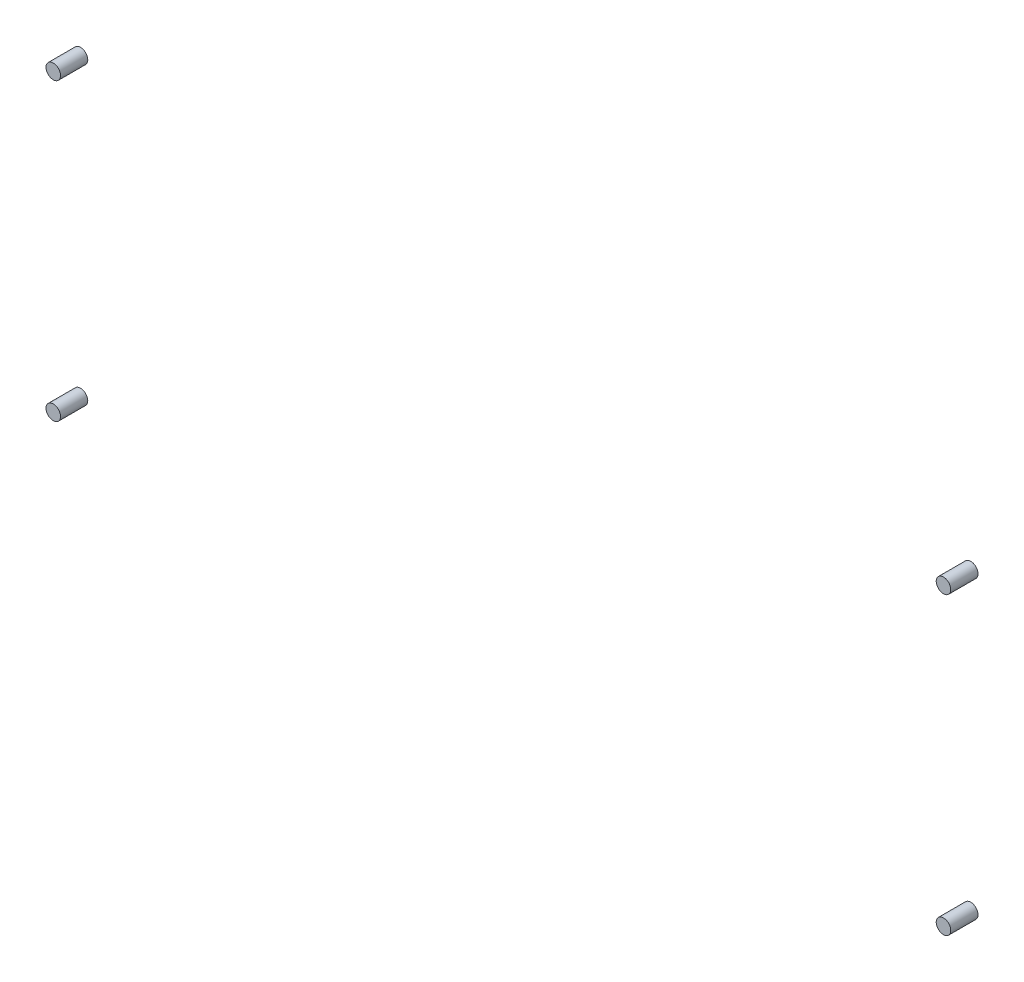
from build123d import *

# Parameters (mm, degrees)
SKETCH_1_W          = 432
SKETCH_1_H          = 330
EXTRUDE_1_DEPTH     = 12
SKETCH_2_OUTSIDE_W  = 542.75
SKETCH_2_OUTSIDE_H  = 440.75
SKETCH_2_OUTSIDE_R  = 3.2
CUT_EXTRUDE_1_DEPTH = 492.927840237


with BuildPart() as part:
    # 草图1 → 凸台-拉伸1 (new body)
    with BuildSketch(Plane.XY):
        with Locations((216, 70)):
            Rectangle(SKETCH_1_W, SKETCH_1_H)
    extrude(amount=EXTRUDE_1_DEPTH)

    # 草图2 outside → 切除-拉伸1 (cut, through all)
    with BuildSketch(Plane.XY.offset(12)):
        with Locations((216, 70)):
            Rectangle(SKETCH_2_OUTSIDE_W, SKETCH_2_OUTSIDE_H)
        with Locations((20, -42)):
            Circle(SKETCH_2_OUTSIDE_R, mode=Mode.SUBTRACT)
        with Locations((412, -42)):
            Circle(SKETCH_2_OUTSIDE_R, mode=Mode.SUBTRACT)
        with Locations((20, 88)):
            Circle(SKETCH_2_OUTSIDE_R, mode=Mode.SUBTRACT)
        with Locations((412, 88)):
            Circle(SKETCH_2_OUTSIDE_R, mode=Mode.SUBTRACT)
    extrude(amount=-CUT_EXTRUDE_1_DEPTH, mode=Mode.SUBTRACT)


with BuildPart() as cut_extrude_1_piece_1:
    # of the separate pieces the step leaves, piece 1, a body of its own (cut_extrude_1_pieces)
    add(part.part.solids().sort_by_distance((23.2, -42, 0))[0])


with BuildPart() as cut_extrude_1_piece_2:
    # of the separate pieces the step leaves, piece 2, a body of its own (cut_extrude_1_pieces)
    add(part.part.solids().sort_by_distance((23.2, 88, 0))[0])


with BuildPart() as cut_extrude_1_piece_3:
    # of the separate pieces the step leaves, piece 3, a body of its own (cut_extrude_1_pieces)
    add(part.part.solids().sort_by_distance((415.2, -42, 0))[0])


with BuildPart() as cut_extrude_1_piece_4:
    # of the separate pieces the step leaves, piece 4, a body of its own (cut_extrude_1_pieces)
    add(part.part.solids().sort_by_distance((415.2, 88, 0))[0])


solid = Compound([cut_extrude_1_piece_1.part, cut_extrude_1_piece_2.part, cut_extrude_1_piece_3.part, cut_extrude_1_piece_4.part])
